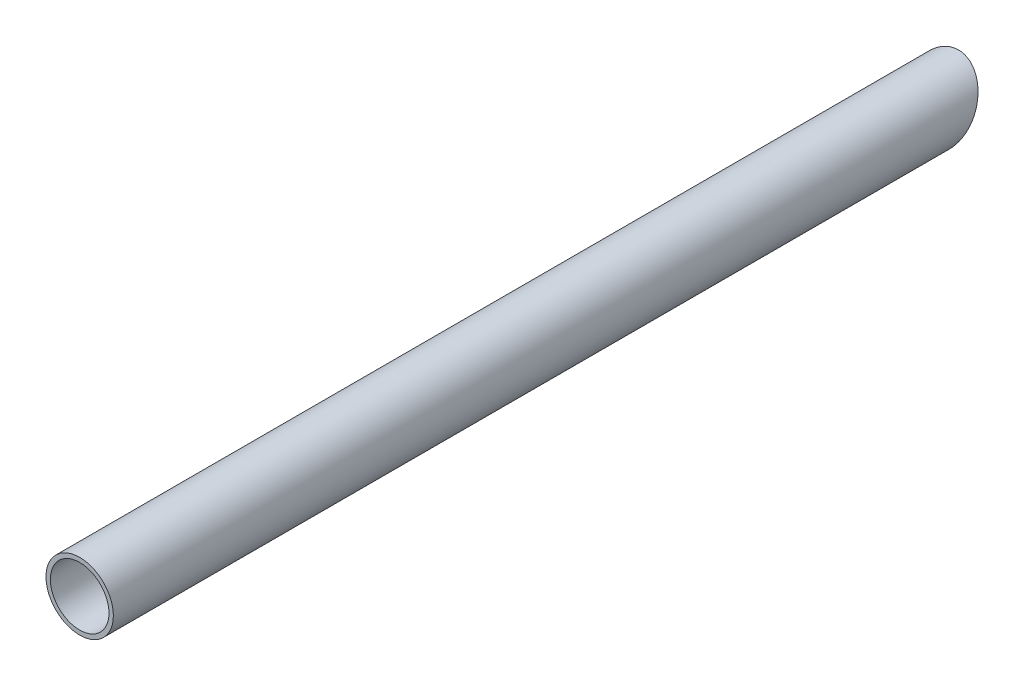
from build123d import *

# Parameters (mm, degrees)
SKETCH1_R           = 11.5
SKETCH1_R_2         = 10
EXTRUDE_THIN1_DEPTH = 150
CUT_EXTRUDE1_DEPTH  = 15


with BuildPart() as part:
    # Sketch1 → Extrude-Thin1 (new, symmetric)
    with BuildSketch(Plane.XY):
        Circle(SKETCH1_R)
        Circle(SKETCH1_R_2, mode=Mode.SUBTRACT)
    extrude(amount=EXTRUDE_THIN1_DEPTH, both=True)

    # Sketch2 → Cut-Extrude1 (cut, symmetric)
    with BuildSketch(Plane(origin=(0, 0, 0), x_dir=(0, 0, -1), z_dir=(1, 0, 0))):
        Polygon((150, 11.5), (136.720943809, -11.5), (150, -11.5), align=None)
    extrude(amount=CUT_EXTRUDE1_DEPTH, both=True, mode=Mode.SUBTRACT)


solid = part.part
